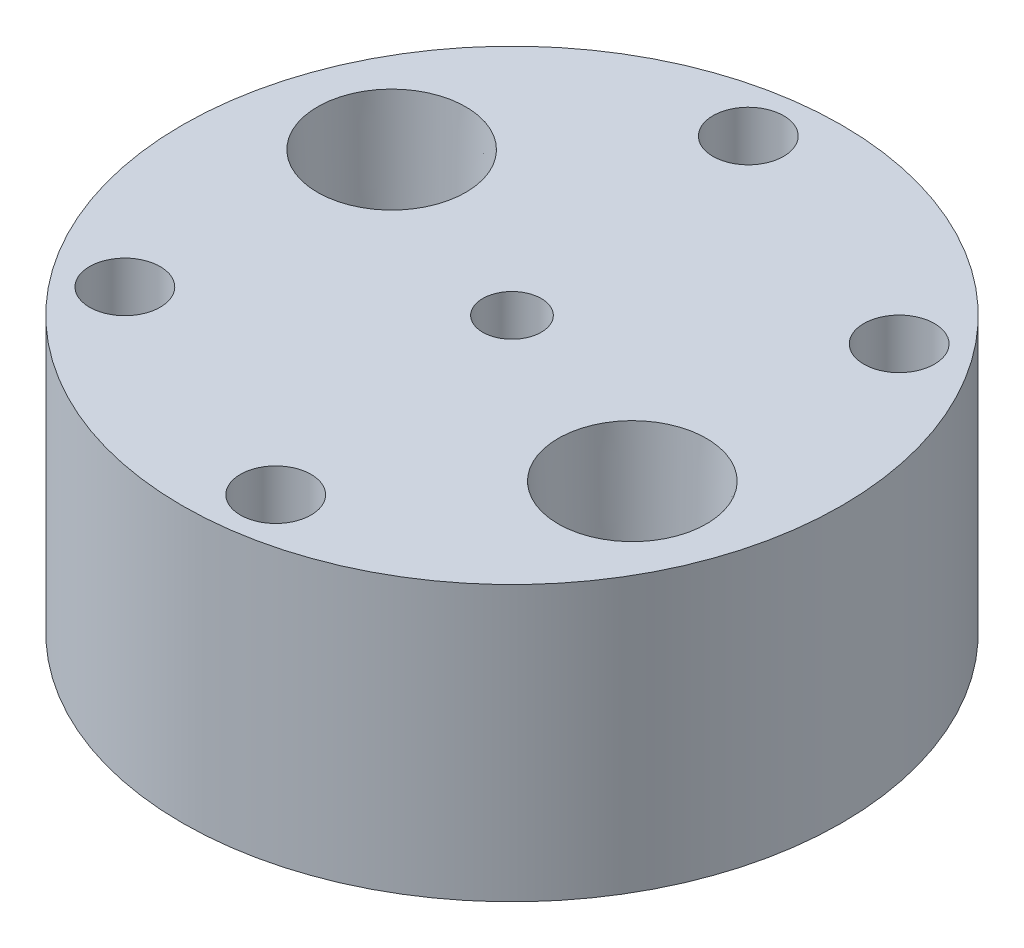
from build123d import *

# Parameters (mm, degrees)
SKETCH1_R                         = 30.48
BOSS_EXTRUDE1_DEPTH               = 25.4
F_1_4_28_TAPPED_HOLE1_D           = 5.4102
SKETCH7_R                         = 11.43
CUT_EXTRUDE2_DEPTH                = 12.7
F_1_4_CLEARANCE_HOLE1_D           = 6.5278
F_1_4_NPT_TAPPED_HOLE1_AT_2_COUNT = 2
F_1_4_NPT_TAPPED_HOLE1_AT_2_PITCH = 40.7035
CUT_EXTRUDE3_DEPTH                = 12.7
GASKET_SLOT_DEPTH                 = 1.016


with BuildPart() as part:
    # Sketch1 → Boss-Extrude1 (new body)
    with BuildSketch(Plane(origin=(0, 0, 0), x_dir=(1, 0, 0), z_dir=(0, 1, 0))):
        with Locations(Location((0, 0, 0), (0, 0, 270))):
            Circle(SKETCH1_R)
    extrude(amount=BOSS_EXTRUDE1_DEPTH)

    # 1/4-28 Tapped Hole1 (through all)
    with Locations(Plane(origin=(0, 25.4, 0), x_dir=(1, 0, 0), z_dir=(0, 1, 0))):
        with Locations((0, 0)):
            Hole(F_1_4_28_TAPPED_HOLE1_D / 2)

    # Sketch7 → Cut-Extrude2 (cut)
    with BuildSketch(Plane.XZ):
        with Locations(Location((0, 0, 0), (0, 0, 270))):
            Circle(SKETCH7_R)
    extrude(amount=-CUT_EXTRUDE2_DEPTH, mode=Mode.SUBTRACT)

    # 1/4 Clearance Hole1 (through all)
    with Locations(Plane(origin=(0, 25.4, 0), x_dir=(1, 0, 0), z_dir=(0, 1, 0))):
        with Locations((20.175514493, 15.615257641), (3.435452557, -25.280136906), (-3.435452557, 25.280136906), (-20.175514493, -15.615257641)):
            Hole(F_1_4_CLEARANCE_HOLE1_D / 2)

    # Sketch12 → 1/4 NPT Tapped Hole1 (revolve, cut)
    with BuildSketch(Plane(origin=(-18.83486521, 25.4, -7.709836613), x_dir=(0, 0, 1), z_dir=(1, 0, 0))):
        Polygon((0, 0), (0, 25.4), (5.5626, 25.4), (5.5626, 9.906), (6.557984794, 9.906), (6.8545837, 0), align=None)
    f_1_4_npt_tapped_hole1 = revolve(axis=Axis((-18.83486521, 31.75, -7.709836613), (0, -1, 0)), mode=Mode.SUBTRACT)

    # 1/4 NPT Tapped Hole1 at 2: 1/4 NPT Tapped Hole1 ×2
    with Locations(*[Vector(0.9254666163685309, 0, 0.37882917256645177) * (i * F_1_4_NPT_TAPPED_HOLE1_AT_2_PITCH) for i in range(1, F_1_4_NPT_TAPPED_HOLE1_AT_2_COUNT)]):
        add(f_1_4_npt_tapped_hole1, mode=Mode.SUBTRACT)

    # Sketch13 → Cut-Extrude3 (cut)
    with BuildSketch(Plane.XZ):
        with BuildLine():
            Line((-7.195822597, 8.880598919), (-22.336832207, -3.387945139))
            ThreePointArc((-22.336832207, -3.387945139), (-23.98286581, -9.817111768), (-18.30123054, -13.246780969))
            Line((-18.30123054, -13.246780969), (1.096509596, -11.377282923))
            ThreePointArc((1.096509596, -11.377282923), (4.330017442, -10.578083425), (7.195822597, -8.880598919))
            Line((7.195822597, -8.880598919), (22.336832207, 3.387945139))
            ThreePointArc((22.336832207, 3.387945139), (23.98286581, 9.817111768), (18.30123054, 13.246780969))
            Line((18.30123054, 13.246780969), (-1.096509596, 11.377282923))
            ThreePointArc((-1.096509596, 11.377282923), (-4.330017442, 10.578083425), (-7.195822597, 8.880598919))
        make_face()
    extrude(amount=-CUT_EXTRUDE3_DEPTH, mode=Mode.SUBTRACT)

    # Sketch16 → gasket slot (cut)
    with BuildSketch(Plane.XZ):
        with BuildLine():
            Line((18.008827981, 16.280723081), (-1.388912154, 14.411225036))
            ThreePointArc((-1.388912154, 14.411225036), (-5.48468876, 13.398905672), (-9.114708623, 11.24875863))
            Line((-9.114708623, 11.24875863), (-24.255718233, -1.019785427))
            ThreePointArc((-24.255718233, -1.019785427), (-26.803688057, -10.971783086), (-18.008827981, -16.280723081))
            Line((-18.008827981, -16.280723081), (1.388912154, -14.411225036))
            ThreePointArc((1.388912154, -14.411225036), (5.48468876, -13.398905672), (9.114708623, -11.24875863))
            Line((9.114708623, -11.24875863), (24.255718233, 1.019785427))
            ThreePointArc((24.255718233, 1.019785427), (26.803688057, 10.971783086), (18.008827981, 16.280723081))
        make_face()
        with BuildLine():
            Line((18.15502926, 14.763752025), (-1.242710875, 12.894253979))
            ThreePointArc((-1.242710875, 12.894253979), (-4.907353101, 11.988494548), (-8.15526561, 10.064678774))
            Line((-8.15526561, 10.064678774), (-23.29627522, -2.203865283))
            ThreePointArc((-23.29627522, -2.203865283), (-25.393276933, -10.394447427), (-18.15502926, -14.763752025))
            Line((-18.15502926, -14.763752025), (1.242710875, -12.894253979))
            ThreePointArc((1.242710875, -12.894253979), (4.907353101, -11.988494548), (8.15526561, -10.064678774))
            Line((8.15526561, -10.064678774), (23.29627522, 2.203865283))
            ThreePointArc((23.29627522, 2.203865283), (25.393276933, 10.394447427), (18.15502926, 14.763752025))
        make_face(mode=Mode.SUBTRACT)
    extrude(amount=-GASKET_SLOT_DEPTH, mode=Mode.SUBTRACT)


solid = part.part
